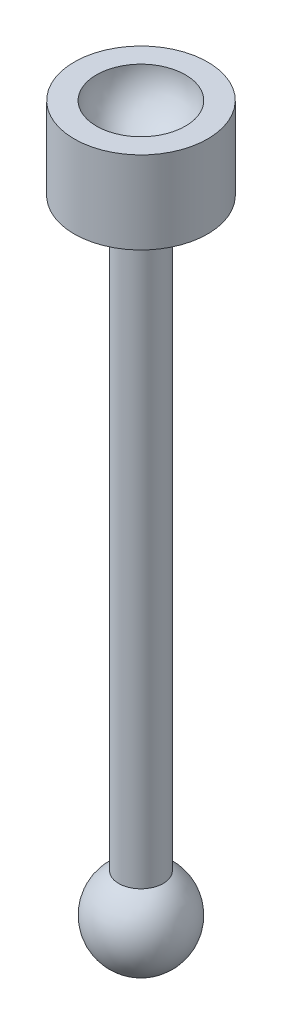
from build123d import *

# Parameters (mm, degrees)
SKETCH3_W = 15
SKETCH3_H = 18.520312213


with BuildPart() as part:
    # Sketch1 → Revolve1 (revolve)
    with BuildSketch(Plane.XY, mode=Mode.PRIVATE) as revolve1_sk:
        with BuildLine():
            Line((0, 41.73429327), (5, 41.73429327))
            Line((5, 41.73429327), (5, -108.26570673))
            ThreePointArc((5, -108.26570673), (9.659258263, -119.514151219), (0, -126.925960768))
            Line((0, -126.925960768), (0, 41.73429327))
        make_face()
    revolve(revolve1_sk.sketch.rotate(Axis((0, 41.73429327, 0), (0, -1, 0)), 180), axis=Axis((0, 41.73429327, 0), (0, -1, 0)))

    # Sketch3 → Revolve3 (revolve)
    with BuildSketch(Plane.XY, mode=Mode.PRIVATE) as revolve3_sk:
        with Locations((7.5, 32.474137164)):
            Rectangle(SKETCH3_W, SKETCH3_H)
    revolve(revolve3_sk.sketch.rotate(Axis((0, 41.73429327, 0), (0, -1, 0)), 90), axis=Axis((0, 41.73429327, 0), (0, -1, 0)))

    # Sketch5 → Cut-Revolve2 (revolve, cut)
    with BuildSketch(Plane.XY):
        with BuildLine():
            Line((0, 41.73429327), (0, 31.73429327))
            ThreePointArc((0, 31.73429327), (7.071067812, 34.663225458), (10, 41.73429327))
            Line((10, 41.73429327), (0, 41.73429327))
        make_face()
    revolve(axis=Axis((0, 41.73429327, 0), (0, -1, 0)), mode=Mode.SUBTRACT)


solid = part.part
